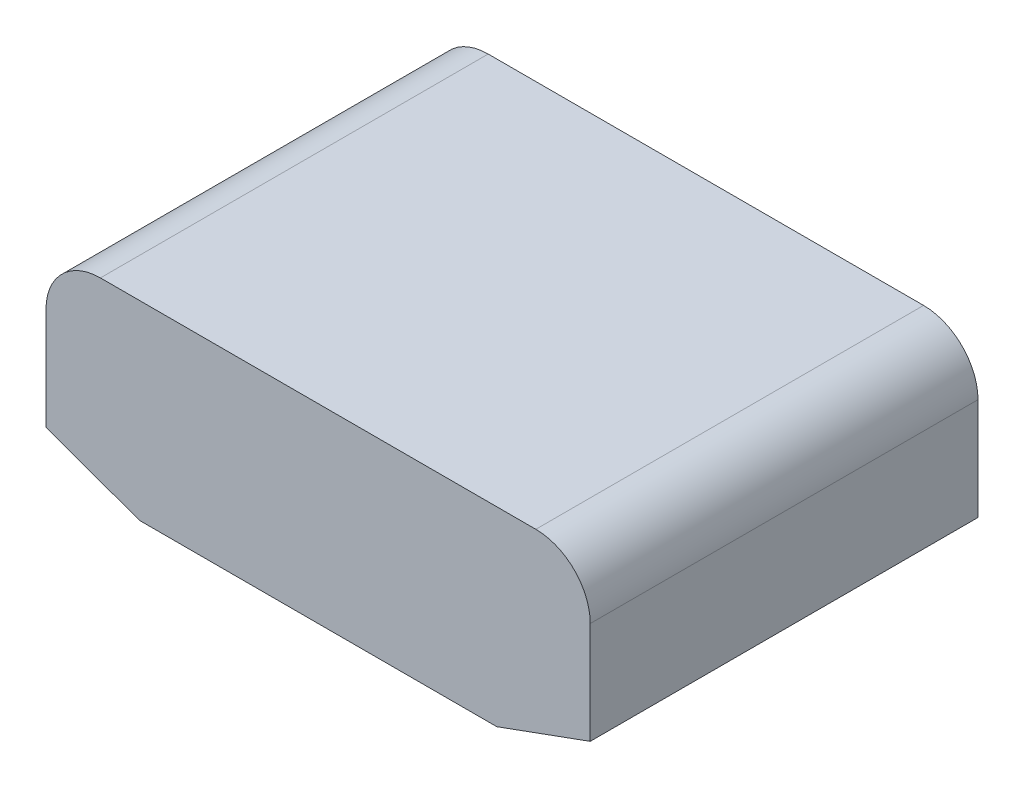
from build123d import *
from OCP.BRepFilletAPI import BRepFilletAPI_MakeChamfer

# Parameters (mm, degrees)
SKETCH_1_W          = 8
SKETCH_1_H          = 1
SKETCH_1_H_2        = 1.8
EXTRUDE_1_DEPTH     = 5.7
FILLET_1_R          = 0.8
CHAMFER_1_SIZE      = 0.5
CHAMFER_1_SIZE2     = 1.37373871
SKETCH_2_W          = 4.700894011
SKETCH_2_H          = 0.61177093
CUT_EXTRUDE_1_DEPTH = 5


with BuildPart() as part:
    # Эскиз1 → Бобышка-Вытянуть1 (new body)
    with BuildSketch(Plane.XY):
        with Locations((-3.289153283, 2.3)):
            Rectangle(SKETCH_1_W, SKETCH_1_H)
        with Locations((-3.289153283, 0.9)):
            Rectangle(SKETCH_1_W, SKETCH_1_H_2)
    extrude(amount=EXTRUDE_1_DEPTH)

    # Скругление1
    fillet_1_edges = [part.edges().sort_by_distance(p)[0] for p in [
        (0.710846717, 2.8, 2.85),
        (-7.289153283, 2.8, 2.85),
    ]]
    fillet(fillet_1_edges, radius=FILLET_1_R)

    # Фаска1: one chamfer whose edges measure the first distance from different faces: ONE call of the kernel's chamfer builder (chamfer() names one face for all edges)
    chamfer_1_edges_1 = [part.edges().sort_by_distance(p)[0] for p in [
        (0.710846717, 0, 2.85),
    ]]
    chamfer_1_side_1 = [part.faces().sort_by_distance(p)[0] for p in [
        (0.710846717, 1, 2.85),
    ]]
    chamfer_1_edges_2 = [part.edges().sort_by_distance(p)[0] for p in [
        (-7.289153283, 0, 2.85),
    ]]
    chamfer_1_side_2 = [part.faces().sort_by_distance(p)[0] for p in [
        (-7.289153283, 1, 2.85),
    ]]
    chamfer_1 = BRepFilletAPI_MakeChamfer(part.part.solid().wrapped)
    for e in chamfer_1_edges_1:
        chamfer_1.Add(CHAMFER_1_SIZE, CHAMFER_1_SIZE2, e.wrapped, chamfer_1_side_1[0].wrapped)  # the first distance lies on this face
    for e in chamfer_1_edges_2:
        chamfer_1.Add(CHAMFER_1_SIZE, CHAMFER_1_SIZE2, e.wrapped, chamfer_1_side_2[0].wrapped)  # the first distance lies on this face
    add(Compound.cast(chamfer_1.Shape()), mode=Mode.REPLACE)

    # Эскиз2 → Вырез-Вытянуть1 (cut)
    with BuildSketch(Plane(origin=(0, 0, 0), x_dir=(-1, 0, 0), z_dir=(0, 0, -1))):
        with BuildLine():
            Line((-0.310846717, 2), (-0.310846717, 0.780083015))
            Line((-0.310846717, 0.780083015), (0.733422785, 0.4))
            Line((0.733422785, 0.4), (5.844883781, 0.4))
            Line((5.844883781, 0.4), (6.889153283, 0.780083015))
            Line((6.889153283, 0.780083015), (6.889153283, 2))
            ThreePointArc((6.889153283, 2), (6.771995996, 2.282842712), (6.489153283, 2.4))
            Line((6.489153283, 2.4), (0.089153283, 2.4))
            ThreePointArc((0.089153283, 2.4), (-0.193689429, 2.282842712), (-0.310846717, 2))
        make_face()
        with Locations((3.494436776, 1.42533527)):
            Rectangle(SKETCH_2_W, SKETCH_2_H, mode=Mode.SUBTRACT)
    extrude(amount=-CUT_EXTRUDE_1_DEPTH, mode=Mode.SUBTRACT)


solid = part.part
